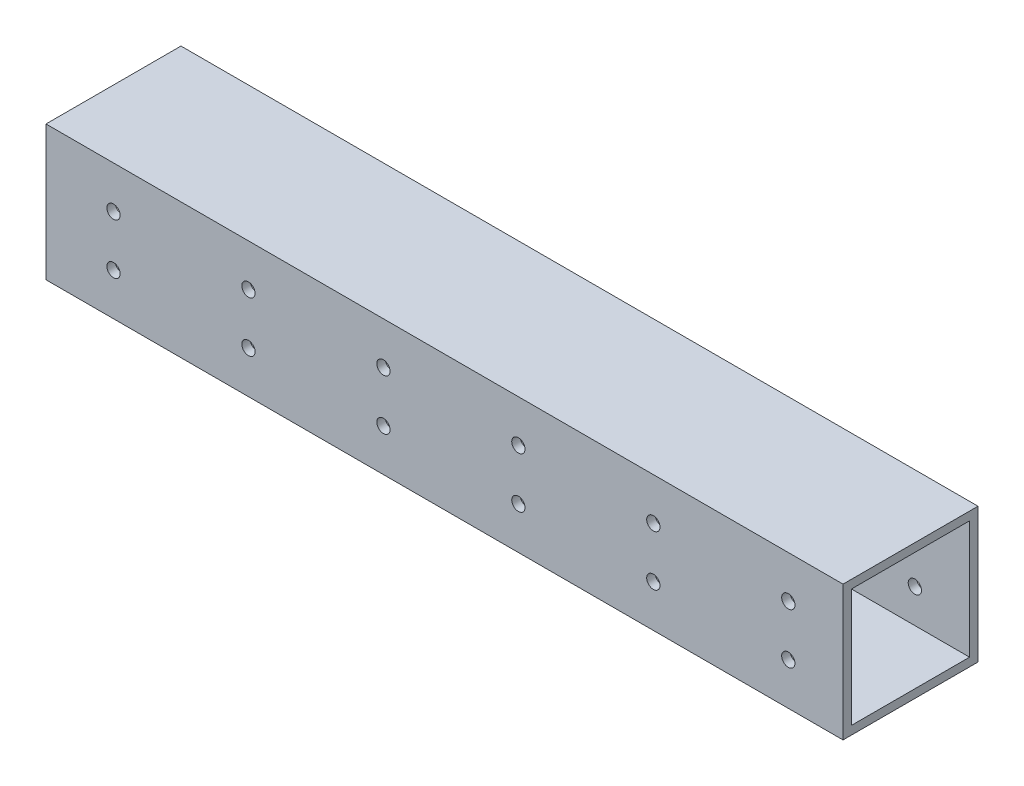
from build123d import *

# Parameters (mm, degrees)
SKETCH1_W           = 50.8
SKETCH1_H           = 50.8
SKETCH1_W_2         = 44.45
SKETCH1_H_2         = 44.45
BOSS_EXTRUDE1_DEPTH = 300
SKETCH2_R           = 2.5
CUT_EXTRUDE1_DEPTH  = 300


with BuildPart() as part:
    # Sketch1 → Boss-Extrude1 (new body)
    with BuildSketch(Plane(origin=(0, 0, 0), x_dir=(0, 0, -1), z_dir=(1, 0, 0))):
        with Locations((25.4, 25.4)):
            Rectangle(SKETCH1_W, SKETCH1_H)
        with Locations((25.4, 25.4)):
            Rectangle(SKETCH1_W_2, SKETCH1_H_2, mode=Mode.SUBTRACT)
    extrude(amount=BOSS_EXTRUDE1_DEPTH)

    # Sketch2 → Cut-Extrude1 (cut)
    with BuildSketch(Plane.XY):
        with Locations((25.4, 15.875)):
            Circle(SKETCH2_R)
        with Locations((76.2, 15.875)):
            Circle(SKETCH2_R)
        with Locations((127, 15.875)):
            Circle(SKETCH2_R)
        with Locations((177.8, 15.875)):
            Circle(SKETCH2_R)
        with Locations((228.6, 15.875)):
            Circle(SKETCH2_R)
        with Locations((279.4, 15.875)):
            Circle(SKETCH2_R)
        with Locations((76.2, 34.925)):
            Circle(SKETCH2_R)
        with Locations((127, 34.925)):
            Circle(SKETCH2_R)
        with Locations((177.8, 34.925)):
            Circle(SKETCH2_R)
        with Locations((228.6, 34.925)):
            Circle(SKETCH2_R)
        with Locations((279.4, 34.925)):
            Circle(SKETCH2_R)
        with Locations((25.4, 34.925)):
            Circle(SKETCH2_R)
    extrude(amount=-CUT_EXTRUDE1_DEPTH, mode=Mode.SUBTRACT)


solid = part.part
